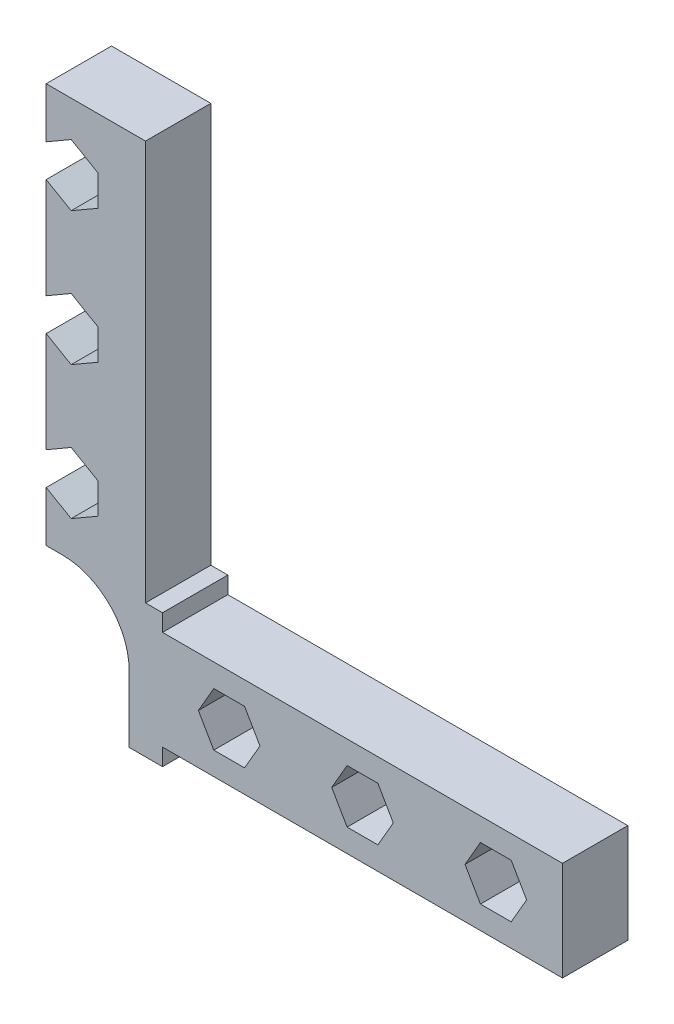
from build123d import *

# Parameters (mm, degrees)
BOSS_EXTRUDE1_DEPTH    = 12.446
CUT_EXTRUDE1_DEPTH     = 145.222130465
F_10_CLEARANCE_HOLE1_D = 5.1054
CUT_EXTRUDE2_DEPTH     = 145.222130465


with BuildPart() as part:
    # Sketch1 → Boss-Extrude1 (new body)
    with BuildSketch(Plane.XY):
        Polygon((0, 0), (0, 25.4), (3.2385, 25.4), (3.2385, 101.6), (22.1615, 101.6), (22.1615, 25.4), (25.4, 25.4), (25.4, 22.1615), (101.6, 22.1615), (101.6, 3.2385), (25.4, 3.2385), (25.4, 0), align=None)
    extrude(amount=BOSS_EXTRUDE1_DEPTH)

    # Sketch2 → Cut-Extrude1 (cut, through all)
    with BuildSketch(Plane.XY.offset(12.446)):
        with BuildLine():
            Line((6.35, 25.4), (0, 25.4))
            Line((0, 25.4), (0, 0))
            Line((0, 0), (19.05, 0))
            Line((19.05, 0), (19.05, 12.7))
            ThreePointArc((19.05, 12.7), (15.330256121, 21.680256121), (6.35, 25.4))
        make_face()
    extrude(amount=-CUT_EXTRUDE1_DEPTH, mode=Mode.SUBTRACT)

    # #10 Clearance Hole1 (through all)
    with Locations(Plane.XY.offset(12.446)):
        with Locations((88.9, 12.7), (8.001, 88.9), (8.001, 63.5), (8.001, 38.1), (38.1, 12.7), (63.5, 12.7)):
            Hole(F_10_CLEARANCE_HOLE1_D / 2)

    # Sketch5 → Cut-Extrude2 (cut, through all)
    with BuildSketch(Plane.XY.offset(12.446)):
        Polygon((13.081, 85.967060633), (13.081, 91.832939367), (8.001, 94.765878735), (2.921, 91.832939367), (2.921, 85.967060633), (8.001, 83.034121265), align=None)
        Polygon((13.081, 60.567060633), (13.081, 66.432939367), (8.001, 69.365878735), (2.921, 66.432939367), (2.921, 60.567060633), (8.001, 57.634121265), align=None)
        Polygon((13.081, 35.167060633), (13.081, 41.032939367), (8.001, 43.965878735), (2.921, 41.032939367), (2.921, 35.167060633), (8.001, 32.234121265), align=None)
        Polygon((41.032939367, 7.62), (43.965878735, 12.7), (41.032939367, 17.78), (35.167060633, 17.78), (32.234121265, 12.7), (35.167060633, 7.62), align=None)
        Polygon((66.432939367, 7.62), (69.365878735, 12.7), (66.432939367, 17.78), (60.567060633, 17.78), (57.634121265, 12.7), (60.567060633, 7.62), align=None)
        Polygon((91.832939367, 7.62), (94.765878735, 12.7), (91.832939367, 17.78), (85.967060633, 17.78), (83.034121265, 12.7), (85.967060633, 7.62), align=None)
    extrude(amount=-CUT_EXTRUDE2_DEPTH, mode=Mode.SUBTRACT)


solid = part.part
